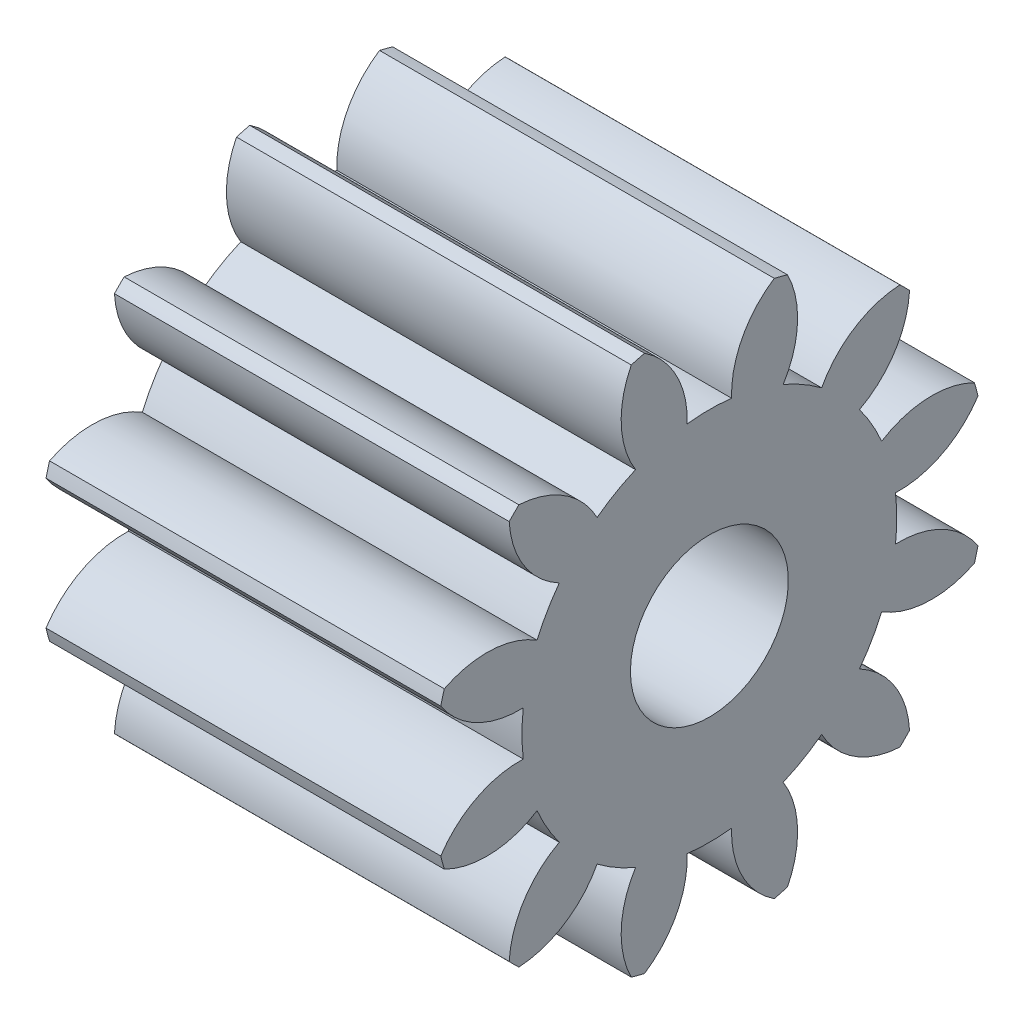
from build123d import *

# Parameters (mm, degrees)
BASPROSKE_W     = 5
BASPROSKE_H     = 3.5
TOOTHCUT_DEPTH  = 8.03562364
TEETHCUTS_COUNT = 12
TEETHCUTS_ANGLE = 330
BORSKE_R        = 1
BORE_DEPTH      = 50.0000508


with BuildPart() as part:
    # BasProSke → Base-Revolve (revolve)
    with BuildSketch(Plane(origin=(0, 0, 0), x_dir=(1, 0, 0), z_dir=(0, 1, 0)), mode=Mode.PRIVATE) as base_revolve_sk:
        with Locations((2.5, 1.75)):
            Rectangle(BASPROSKE_W, BASPROSKE_H)
    revolve(base_revolve_sk.sketch.rotate(Axis((-10, 0, 0), (1, 0, 0)), 180), axis=Axis((-10, 0, 0), (1, 0, 0)))

    # TooCutSke → ToothCut (cut, through all)
    with BuildSketch(Plane(origin=(0, 0, 0), x_dir=(0, 0, -1), z_dir=(1, 0, 0))):
        with BuildLine():
            ThreePointArc((0.281121165, 2.357296522), (0, 2.374), (-0.281121165, 2.357296522))
            ThreePointArc((-0.281121165, 2.357296522), (-0.422795142, 2.966088489), (-0.851415412, 3.421043256))
            ThreePointArc((-0.851415412, 3.421043256), (0, 3.5254), (0.851415412, 3.421043256))
            ThreePointArc((0.851415412, 3.421043256), (0.422795142, 2.966088489), (0.281121165, 2.357296522))
        make_face()
    toothcut = extrude(amount=TOOTHCUT_DEPTH, mode=Mode.SUBTRACT)

    # TeethCuts: ToothCut ×12 about axis
    teethcuts_axis = Axis((-10, 0, 0), (1, 0, 0))
    for i in range(1, TEETHCUTS_COUNT):
        add(toothcut.rotate(teethcuts_axis, i * TEETHCUTS_ANGLE / (TEETHCUTS_COUNT - 1)), mode=Mode.SUBTRACT)

    # BorSke → Bore (cut, symmetric)
    with BuildSketch(Plane(origin=(0, 0, 0), x_dir=(0, 0, -1), z_dir=(1, 0, 0))):
        with Locations(Location((0, 0, 0), (0, 0, 180))):
            Circle(BORSKE_R)
    extrude(amount=BORE_DEPTH, both=True, mode=Mode.SUBTRACT)


solid = part.part
